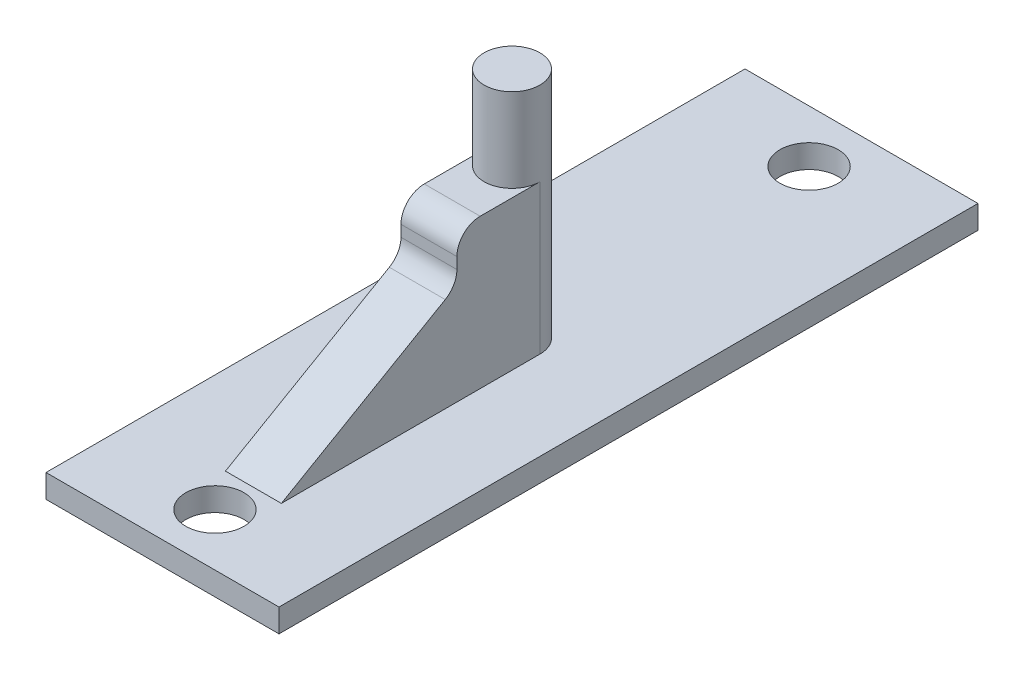
from build123d import *

# Parameters (mm, degrees)
SKETCH1_W           = 20
SKETCH1_H           = 60
BOSS_EXTRUDE1_DEPTH = 2
SKETCH2_R           = 2.5
CUT_EXTRUDE1_DEPTH  = 32.685959036
SKETCH3_R           = 2.4
BOSS_EXTRUDE2_DEPTH = 20
BOSS_EXTRUDE7_DEPTH = 4.8
CUT_EXTRUDE2_START  = -1
SKETCH5_R           = 0.5
CUT_EXTRUDE2_DEPTH  = 2


with BuildPart() as part:
    # Sketch1 → Boss-Extrude1 (new body)
    with BuildSketch(Plane(origin=(0, 0, 0), x_dir=(1, 0, 0), z_dir=(0, 1, 0))):
        Rectangle(SKETCH1_W, SKETCH1_H)
    extrude(amount=BOSS_EXTRUDE1_DEPTH)

    # Sketch2 → Cut-Extrude1 (cut, through all)
    with BuildSketch(Plane(origin=(0, 2, 0), x_dir=(1, 0, 0), z_dir=(0, 1, 0))):
        with Locations(Location((0, 25.5, 0), (0, 0, 270))):
            Circle(SKETCH2_R)
        with Locations(Location((0, -25.5, 0), (0, 0, 90))):
            Circle(SKETCH2_R)
    extrude(amount=-CUT_EXTRUDE1_DEPTH, mode=Mode.SUBTRACT)

    # Sketch3 → Boss-Extrude2 (add)
    with BuildSketch(Plane(origin=(0, 2, 0), x_dir=(1, 0, 0), z_dir=(0, 1, 0))):
        with Locations(Location((0, 0, 0), (0, 0, 270))):
            Circle(SKETCH3_R)
    extrude(amount=BOSS_EXTRUDE2_DEPTH)

    # Sketch4 → Boss-Extrude7 (add)
    with BuildSketch(Plane.ZY.offset(2.4)):
        with BuildLine():
            Line((8.130845775, 10.120752848), (22.196402304, 2))
            Line((22.196402304, 2), (0, 2))
            Line((0, 2), (0, 14.815098845))
            Line((0, 14.815098845), (5.130845775, 14.815098845))
            ThreePointArc((5.130845775, 14.815098845), (6.545059338, 14.229312408), (7.130845775, 12.815098845))
            Line((7.130845775, 12.815098845), (7.130845775, 11.852803656))
            ThreePointArc((7.130845775, 11.852803656), (7.398794968, 10.852803656), (8.130845775, 10.120752848))
        make_face()
    extrude(amount=-BOSS_EXTRUDE7_DEPTH)

    # Sketch5 → Cut-Extrude2 (cut)
    with BuildSketch(Plane.XY.offset(CUT_EXTRUDE2_START)):
        with Locations((0, 21.3)):
            Circle(SKETCH5_R)
    extrude(amount=-CUT_EXTRUDE2_DEPTH, mode=Mode.SUBTRACT)


solid = part.part
